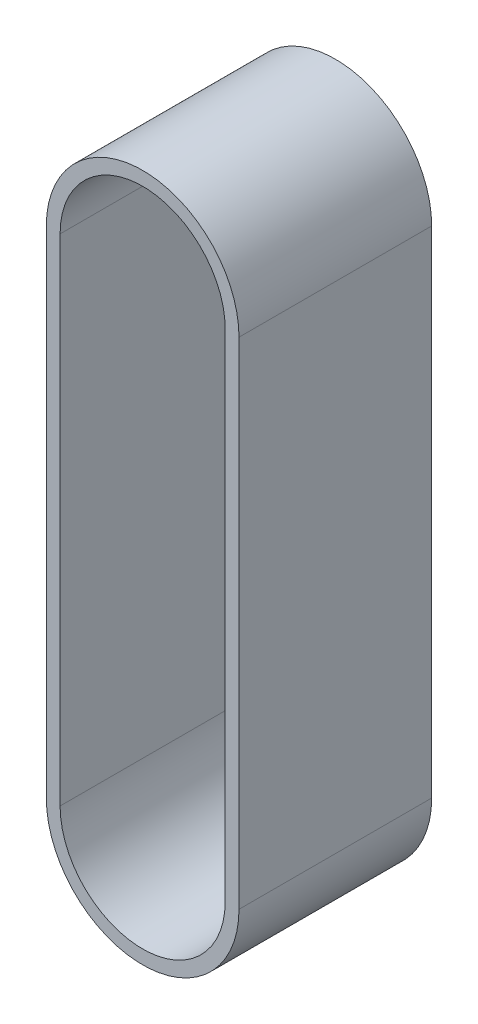
from build123d import *

# Parameters (mm, degrees)
SKETCH1_W           = 70
SKETCH1_H           = 70
BOSS_EXTRUDE1_DEPTH = 250
SKETCH2_R           = 30
CUT_EXTRUDE2_DEPTH  = 65
SKETCH4_R           = 5
CUT_EXTRUDE3_DEPTH  = 261.672207955


with BuildPart() as part:
    # Sketch1 → Boss-Extrude1 (new body)
    with BuildSketch(Plane(origin=(0, 0, 0), x_dir=(1, 0, 0), z_dir=(0, 1, 0))):
        Rectangle(SKETCH1_W, SKETCH1_H)
    extrude(amount=BOSS_EXTRUDE1_DEPTH)

    # Sketch2 → Cut-Extrude2 (cut)
    with BuildSketch(Plane.XY.offset(35)):
        with BuildLine():
            Line((-35, 250), (-35, 215))
            ThreePointArc((-35, 215), (-24.748737311, 239.748737372), (8.5e-08, 250))
            Line((8.5e-08, 250), (-35, 250))
        make_face()
        with BuildLine():
            Line((35, 250), (8.5e-08, 250))
            ThreePointArc((8.5e-08, 250), (24.748737372, 239.748737311), (35, 215))
            Line((35, 215), (35, 250))
        make_face()
        with BuildLine():
            ThreePointArc((1.6e-08, 0), (-24.748737336, 10.251262653), (-35, 35))
            Line((-35, 35), (-35, 0))
            Line((-35, 0), (1.6e-08, 0))
        make_face()
        with BuildLine():
            ThreePointArc((35, 35), (24.748737347, 10.251262664), (1.6e-08, 0))
            Line((1.6e-08, 0), (35, 0))
            Line((35, 0), (35, 35))
        make_face()
        with BuildLine():
            ThreePointArc((30, 215), (0, 185), (-30, 215))
            Line((-30, 215), (-30, 35))
            ThreePointArc((-30, 35), (0, 65), (30, 35))
            Line((30, 35), (30, 215))
        make_face()
        with Locations((0, 215)):
            Circle(SKETCH2_R)
        with Locations((0, 35)):
            Circle(SKETCH2_R)
    extrude(amount=-CUT_EXTRUDE2_DEPTH, mode=Mode.SUBTRACT)

    # Sketch4 → Cut-Extrude3 (cut, through all)
    with BuildSketch(Plane.XY.offset(-30)):
        with BuildLine():
            ThreePointArc((1.9e-08, 0), (-24.748737335, 10.251262652), (-35, 35))
            Line((-35, 35), (-35, 0))
            Line((-35, 0), (1.9e-08, 0))
        make_face()
        with BuildLine():
            Line((35, 0), (35, 35))
            ThreePointArc((35, 35), (24.748737348, 10.251262665), (1.9e-08, 0))
            Line((1.9e-08, 0), (35, 0))
        make_face()
        with BuildLine():
            Line((-35, 250), (-35, 215))
            ThreePointArc((-35, 215), (-24.748737474, 239.748737209), (-3.75e-07, 250))
            Line((-3.75e-07, 250), (-35, 250))
        make_face()
        with BuildLine():
            ThreePointArc((-3.75e-07, 250), (24.748737209, 239.748737474), (35, 215))
            Line((35, 215), (35, 250))
            Line((35, 250), (-3.75e-07, 250))
        make_face()
        with Locations((0, 215)):
            Circle(SKETCH4_R)
        with Locations((0, 35)):
            Circle(SKETCH4_R)
    extrude(amount=-CUT_EXTRUDE3_DEPTH, mode=Mode.SUBTRACT)


solid = part.part
